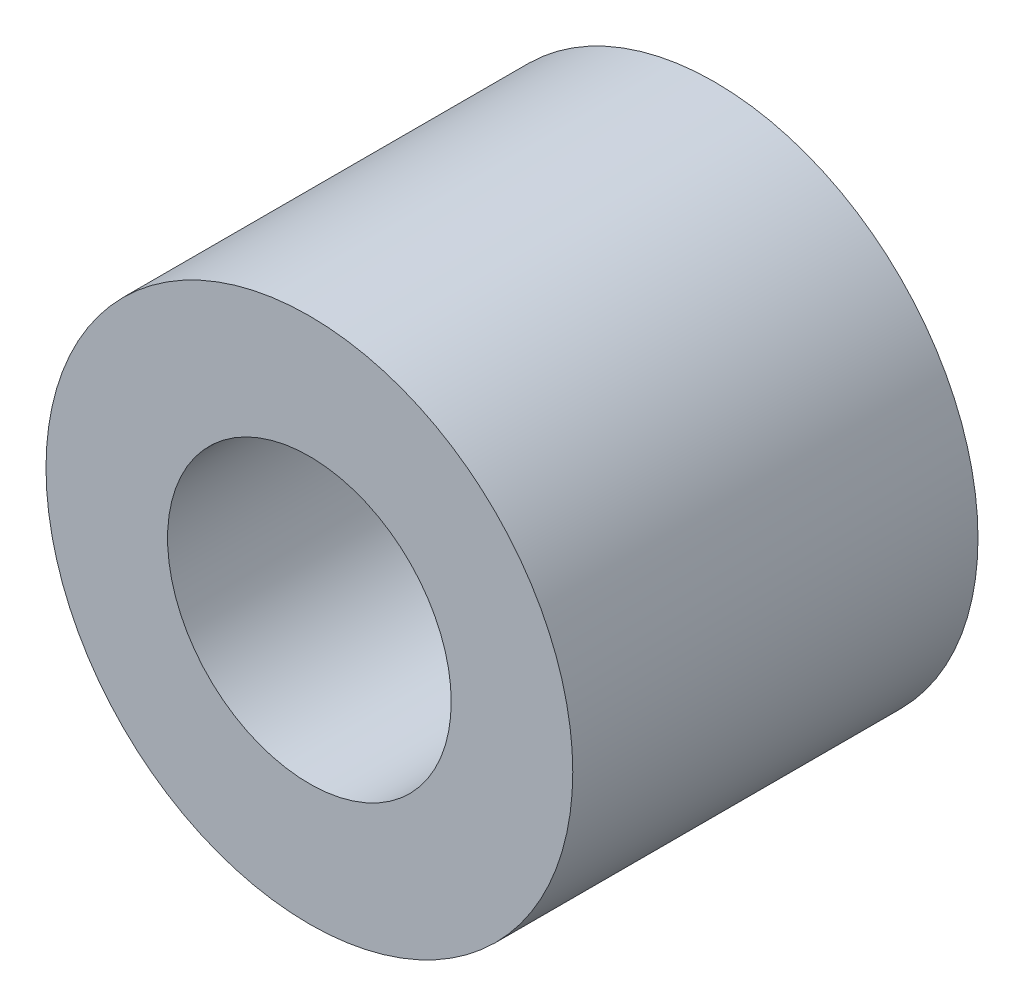
from build123d import *

# Parameters (mm, degrees)
SCHIZZO1_R                   = 3.25
SCHIZZO1_R_2                 = 1.75
ESTRUSIONE_ESTRUSIONE1_DEPTH = 5


with BuildPart() as part:
    # Schizzo1 → Estrusione-Estrusione1 (new body)
    with BuildSketch(Plane.XY):
        Circle(SCHIZZO1_R)
        Circle(SCHIZZO1_R_2, mode=Mode.SUBTRACT)
    extrude(amount=ESTRUSIONE_ESTRUSIONE1_DEPTH)


solid = part.part
